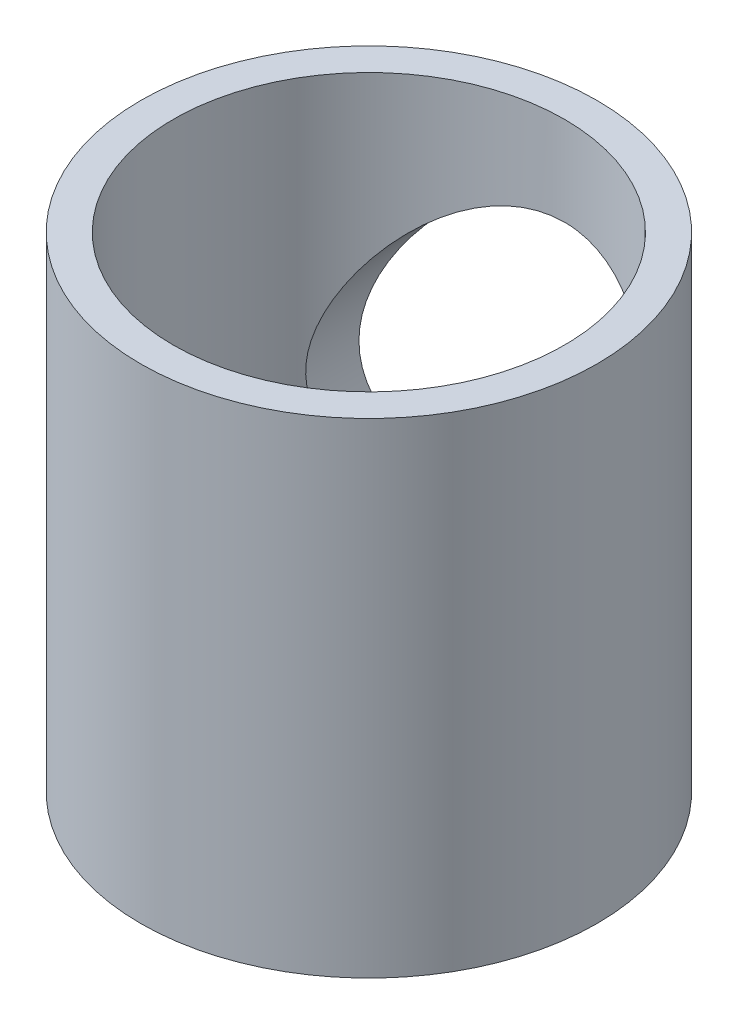
from build123d import *

# Parameters (mm, degrees)
SKETCH1_R           = 10.5
SKETCH1_R_2         = 9
BOSS_EXTRUDE1_DEPTH = 38.3
SKETCH2_R           = 1
SKETCH2_R_2         = 9
BOSS_EXTRUDE2_DEPTH = 1.5
FILLET1_R           = 0.5
SKETCH10_R          = 7.65
CUT_EXTRUDE1_DEPTH  = 46.293682625
SKETCH15_R          = 20.755300819
CUT_EXTRUDE3_DEPTH  = 17.5


with BuildPart() as part:
    # Sketch1 → Boss-Extrude1 (new body)
    with BuildSketch(Plane(origin=(0, 0, 0), x_dir=(1, 0, 0), z_dir=(0, 1, 0))):
        with Locations(Location((0, 0, 0), (0, 0, 270))):
            Circle(SKETCH1_R)
        with Locations(Location((0, 0, 0), (0, 0, 270))):
            Circle(SKETCH1_R_2, mode=Mode.SUBTRACT)
    extrude(amount=BOSS_EXTRUDE1_DEPTH)

    # Sketch2 → Boss-Extrude2 (add)
    with BuildSketch(Plane(origin=(0, 38.3, 0), x_dir=(1, 0, 0), z_dir=(0, 1, 0))):
        with BuildLine():
            Line((-3, -12.1346611), (-3, -12.5))
            ThreePointArc((-3, -12.5), (0, -15.5), (3, -12.5))
            Line((3, -12.5), (3, -12.1346611))
            ThreePointArc((3, -12.1346611), (6.25, -10.825317547), (9.008924778, -8.665406761))
            Line((9.008924778, -8.665406761), (9.325317547, -8.848076211))
            ThreePointArc((9.325317547, -8.848076211), (13.423393759, -7.75), (12.325317547, -3.651923789))
            Line((12.325317547, -3.651923789), (12.008924778, -3.469254338))
            ThreePointArc((12.008924778, -3.469254338), (12.393060767, -1.631577403), (12.497639685, 0.24290392))
            Line((12.497639685, 0.24290392), (12.850529964, 0.337460585))
            ThreePointArc((12.850529964, 0.337460585), (14.971850307, 4.011695199), (11.297615693, 6.133015543))
            Line((11.297615693, 6.133015543), (10.944725414, 6.038458877))
            ThreePointArc((10.944725414, 6.038458877), (7.609517863, 9.916916754), (3, 12.1346611))
            Line((3, 12.1346611), (3, 12.5))
            ThreePointArc((3, 12.5), (0, 15.5), (-3, 12.5))
            Line((-3, 12.5), (-3, 12.1346611))
            ThreePointArc((-3, 12.1346611), (-7.609517863, 9.916916754), (-10.944725414, 6.038458877))
            Line((-10.944725414, 6.038458877), (-11.297615693, 6.133015543))
            ThreePointArc((-11.297615693, 6.133015543), (-14.971850307, 4.011695199), (-12.850529964, 0.337460585))
            Line((-12.850529964, 0.337460585), (-12.497639685, 0.24290392))
            ThreePointArc((-12.497639685, 0.24290392), (-12.393060767, -1.631577403), (-12.008924778, -3.469254338))
            Line((-12.008924778, -3.469254338), (-12.325317547, -3.651923789))
            ThreePointArc((-12.325317547, -3.651923789), (-13.423393759, -7.75), (-9.325317547, -8.848076211))
            Line((-9.325317547, -8.848076211), (-9.008924778, -8.665406761))
            ThreePointArc((-9.008924778, -8.665406761), (-6.25, -10.825317547), (-3, -12.1346611))
        make_face()
        with Locations(Location((-12.074072829, 3.235238064, 0), (0, 0, 270))):
            Circle(SKETCH2_R, mode=Mode.SUBTRACT)
        with Locations(Location((0, 0, 0), (0, 0, 270))):
            Circle(SKETCH2_R_2, mode=Mode.SUBTRACT)
        with Locations((12.074072829, 3.235238064)):
            Circle(SKETCH2_R, mode=Mode.SUBTRACT)
        with Locations(Location((0, -12.5, 0), (0, 0, 270))):
            Circle(SKETCH2_R, mode=Mode.SUBTRACT)
    extrude(amount=BOSS_EXTRUDE2_DEPTH)

    # Fillet1
    fillet1_edges = [part.edges().sort_by_distance(p)[0] for p in [
        (-3, 39.05, 12.1346611),
        (3, 39.05, 12.1346611),
        (9.008924778, 39.05, 8.665406761),
        (12.008924778, 39.05, 3.469254338),
        (12.497639685, 39.05, -0.24290392),
        (10.944725414, 39.05, -6.038458877),
        (3, 39.05, -12.1346611),
        (-3, 39.05, -12.1346611),
        (-10.944725414, 39.05, -6.038458877),
        (-12.497639685, 39.05, -0.24290392),
        (-12.008924778, 39.05, 3.469254338),
        (-9.008924778, 39.05, 8.665406761),
    ]]
    fillet(fillet1_edges, radius=FILLET1_R)

    # Sketch10 → Cut-Extrude1 (cut, through all)
    with BuildSketch(Plane.XY):
        with Locations(Location((0, 10.55, 0), (0, 0, 90))):
            Circle(SKETCH10_R)
    extrude(amount=-CUT_EXTRUDE1_DEPTH, mode=Mode.SUBTRACT)

    # Sketch15 → Cut-Extrude3 (cut)
    with BuildSketch(Plane(origin=(0, 39.8, 0), x_dir=(1, 0, 0), z_dir=(0, 1, 0))):
        Circle(SKETCH15_R)
    extrude(amount=-CUT_EXTRUDE3_DEPTH, mode=Mode.SUBTRACT)


solid = part.part
